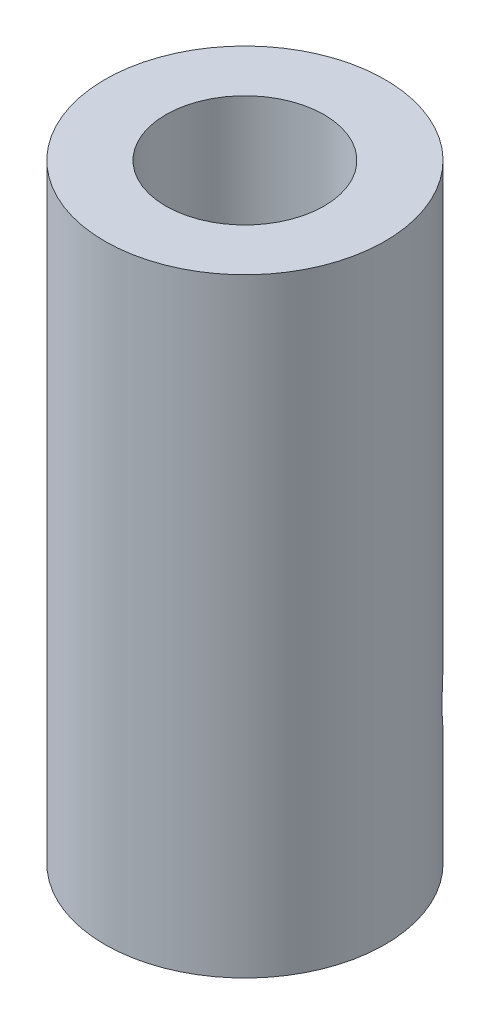
from build123d import *

# Parameters (mm, degrees)
SKETCH1_R           = 4.6
SKETCH1_R_2         = 2.6
BOSS_EXTRUDE1_DEPTH = 20
SKETCH3_R           = 1.4
CUT_EXTRUDE2_DEPTH  = 8


with BuildPart() as part:
    # Sketch1 → Boss-Extrude1 (new body)
    with BuildSketch(Plane(origin=(0, 0, 0), x_dir=(1, 0, 0), z_dir=(0, 1, 0))):
        with Locations(Location((0, 0, 0), (0, 0, 270))):
            Circle(SKETCH1_R)
        with Locations(Location((0, 0, 0), (0, 0, 270))):
            Circle(SKETCH1_R_2, mode=Mode.SUBTRACT)
    extrude(amount=BOSS_EXTRUDE1_DEPTH)

    # Sketch3 → Cut-Extrude2 (cut)
    with BuildSketch(Plane(origin=(-1.472015014, -1.458306646, -9.901493005), x_dir=(-0.8384754610640808, 0, -0.5449393555189213), z_dir=(0.5449393555189213, 0, -0.8384754610640808))):
        with Locations((-6.629961684, 6.289794724)):
            Circle(SKETCH3_R)
    extrude(amount=-CUT_EXTRUDE2_DEPTH, mode=Mode.SUBTRACT)


solid = part.part
